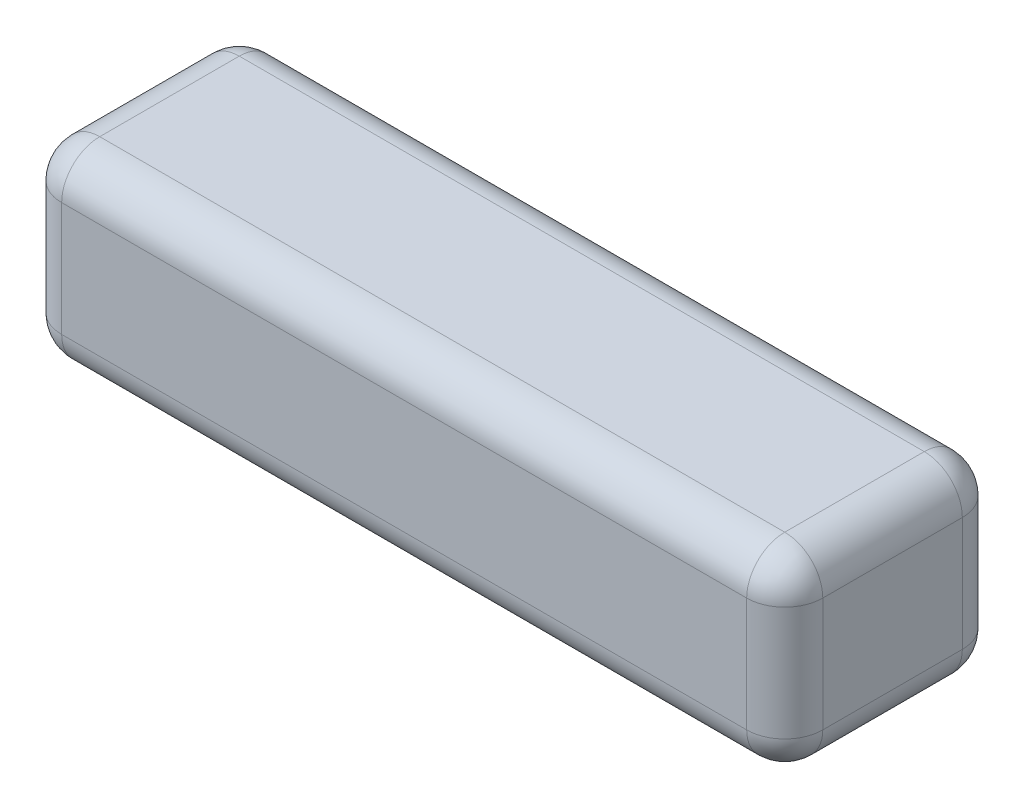
from build123d import *

# Parameters (mm, degrees)
SKETCH1_W           = 60
SKETCH1_H           = 17
BOSS_EXTRUDE1_DEPTH = 15
FILLET2_R           = 3


with BuildPart() as part:
    # Sketch1 → Boss-Extrude1 (new body)
    with BuildSketch(Plane(origin=(0, 0, 0), x_dir=(1, 0, 0), z_dir=(0, 1, 0))):
        Rectangle(SKETCH1_W, SKETCH1_H)
    extrude(amount=BOSS_EXTRUDE1_DEPTH)

    # Fillet2
    fillet2_edges = [part.edges().sort_by_distance(p)[0] for p in [
        (-30, 15, 0),
        (0, 15, 8.5),
        (30, 15, 0),
        (0, 0, 8.5),
        (-30, 0, 0),
        (0, 0, -8.5),
        (30, 0, 0),
        (30, 7.5, 8.5),
        (-30, 7.5, 8.5),
        (-30, 7.5, -8.5),
        (30, 7.5, -8.5),
        (0, 15, -8.5),
    ]]
    fillet(fillet2_edges, radius=FILLET2_R)


solid = part.part
